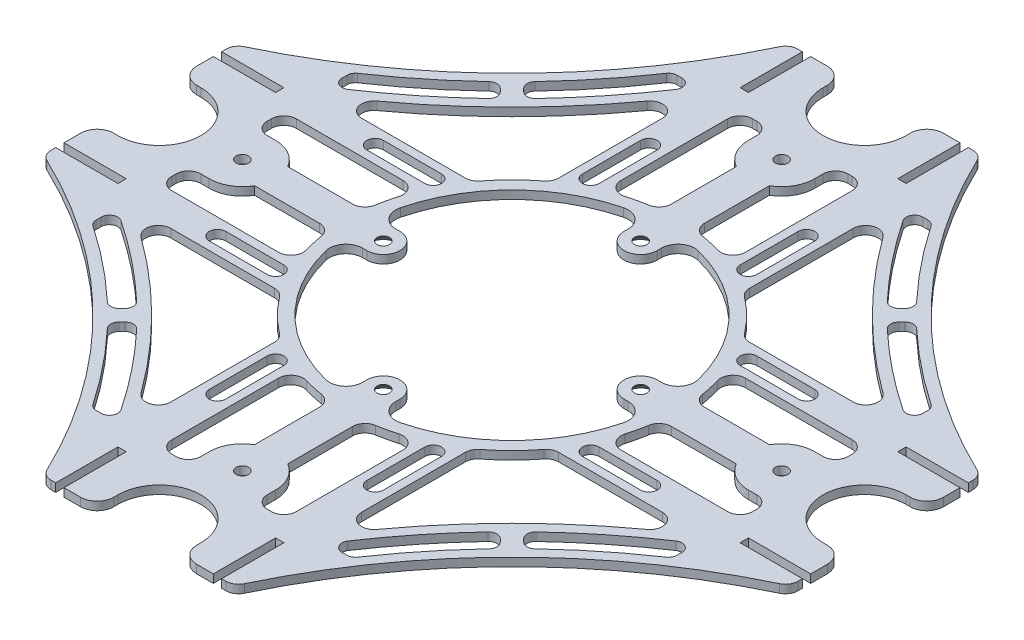
from build123d import *

# Parameters (mm, degrees)
SKETCH1_R           = 1.5
BOSS_EXTRUDE1_DEPTH = 2
CHAMFER1_SIZE       = 1.75


with BuildPart() as part:
    # Sketch1 → Boss-Extrude1 (new body)
    with BuildSketch(Plane(origin=(0, 0, 0), x_dir=(1, 0, 0), z_dir=(0, 1, 0))):
        with BuildLine():
            Line((-21.092083514, 90), (-20, 90))
            Line((-20, 90), (-20, 75))
            Line((-20, 75), (-18, 75))
            Line((-18, 75), (-18, 90))
            Line((-18, 90), (-14, 90))
            ThreePointArc((-14, 90), (-11.171572875, 88.828427125), (-10, 86))
            Line((-10, 86), (-10, 85))
            ThreePointArc((-10, 85), (0, 75), (10, 85))
            Line((10, 85), (10, 86))
            ThreePointArc((10, 86), (11.171572875, 88.828427125), (14, 90))
            Line((14, 90), (18, 90))
            Line((18, 90), (18, 75))
            Line((18, 75), (20, 75))
            Line((20, 75), (20, 90))
            Line((20, 90), (21.092083514, 90))
            ThreePointArc((21.092083514, 90), (22.693292478, 89.536952867), (23.800211296, 88.290753235))
            ThreePointArc((23.800211296, 88.290753235), (50.499949777, 50.499949777), (88.290753235, 23.800211296))
            ThreePointArc((88.290753235, 23.800211296), (89.536952867, 22.693292478), (90, 21.092083514))
            Line((90, 21.092083514), (90, 20))
            Line((90, 20), (75, 20))
            Line((75, 20), (75, 18))
            Line((75, 18), (90, 18))
            Line((90, 18), (90, 14))
            ThreePointArc((90, 14), (88.828427125, 11.171572875), (86, 10))
            Line((86, 10), (85, 10))
            ThreePointArc((85, 10), (75, 0), (85, -10))
            Line((85, -10), (86, -10))
            ThreePointArc((86, -10), (88.828427125, -11.171572875), (90, -14))
            Line((90, -14), (90, -18))
            Line((90, -18), (75, -18))
            Line((75, -18), (75, -20))
            Line((75, -20), (90, -20))
            Line((90, -20), (90, -21.092083514))
            ThreePointArc((90, -21.092083514), (89.536952867, -22.693292478), (88.290753235, -23.800211296))
            ThreePointArc((88.290753235, -23.800211296), (50.499949777, -50.499949777), (23.800211296, -88.290753235))
            ThreePointArc((23.800211296, -88.290753235), (22.693292478, -89.536952867), (21.092083514, -90))
            Line((21.092083514, -90), (20, -90))
            Line((20, -90), (20, -75))
            Line((20, -75), (18, -75))
            Line((18, -75), (18, -90))
            Line((18, -90), (14, -90))
            ThreePointArc((14, -90), (11.171572875, -88.828427125), (10, -86))
            Line((10, -86), (10, -85))
            ThreePointArc((10, -85), (0, -75), (-10, -85))
            Line((-10, -85), (-10, -86))
            ThreePointArc((-10, -86), (-11.171572875, -88.828427125), (-14, -90))
            Line((-14, -90), (-18, -90))
            Line((-18, -90), (-18, -75))
            Line((-18, -75), (-20, -75))
            Line((-20, -75), (-20, -90))
            Line((-20, -90), (-21.092083514, -90))
            ThreePointArc((-21.092083514, -90), (-22.693292478, -89.536952867), (-23.800211296, -88.290753235))
            ThreePointArc((-23.800211296, -88.290753235), (-50.499949777, -50.499949777), (-88.290753235, -23.800211296))
            ThreePointArc((-88.290753235, -23.800211296), (-89.536952867, -22.693292478), (-90, -21.092083514))
            Line((-90, -21.092083514), (-90, -20))
            Line((-90, -20), (-75, -20))
            Line((-75, -20), (-75, -18))
            Line((-75, -18), (-90, -18))
            Line((-90, -18), (-90, -14))
            ThreePointArc((-90, -14), (-88.828427125, -11.171572875), (-86, -10))
            Line((-86, -10), (-85, -10))
            ThreePointArc((-85, -10), (-75, 0), (-85, 10))
            Line((-85, 10), (-86, 10))
            ThreePointArc((-86, 10), (-88.828427125, 11.171572875), (-90, 14))
            Line((-90, 14), (-90, 18))
            Line((-90, 18), (-75, 18))
            Line((-75, 18), (-75, 20))
            Line((-75, 20), (-90, 20))
            Line((-90, 20), (-90, 21.092083514))
            ThreePointArc((-90, 21.092083514), (-89.536952867, 22.693292478), (-88.290753235, 23.800211296))
            ThreePointArc((-88.290753235, 23.800211296), (-50.499949777, 50.499949777), (-23.800211296, 88.290753235))
            ThreePointArc((-23.800211296, 88.290753235), (-22.693292478, 89.536952867), (-21.092083514, 90))
        make_face()
        with Locations(Location((0, 31, 0), (0, 0, 270))):
            Circle(SKETCH1_R, mode=Mode.SUBTRACT)
        with Locations(Location((0, 65, 0), (0, 0, 270))):
            Circle(SKETCH1_R, mode=Mode.SUBTRACT)
        with Locations(Location((65, 0, 0), (0, 0, 270))):
            Circle(SKETCH1_R, mode=Mode.SUBTRACT)
        with Locations(Location((31, 0, 0), (0, 0, 270))):
            Circle(SKETCH1_R, mode=Mode.SUBTRACT)
        with Locations(Location((0, -65, 0), (0, 0, 270))):
            Circle(SKETCH1_R, mode=Mode.SUBTRACT)
        with Locations(Location((0, -31, 0), (0, 0, 270))):
            Circle(SKETCH1_R, mode=Mode.SUBTRACT)
        with Locations(Location((-65, 0, 0), (0, 0, 270))):
            Circle(SKETCH1_R, mode=Mode.SUBTRACT)
        with Locations(Location((-31, 0, 0), (0, 0, 270))):
            Circle(SKETCH1_R, mode=Mode.SUBTRACT)
        with BuildLine():
            Line((4, 31), (4, 32.015621187))
            ThreePointArc((4, 32.015621187), (5.53817018, 35.168301624), (8.96969697, 35.896302543))
            ThreePointArc((8.96969697, 35.896302543), (26.162950904, 26.162950904), (35.896302543, 8.96969697))
            ThreePointArc((35.896302543, 8.96969697), (35.168301624, 5.53817018), (32.015621187, 4))
            Line((32.015621187, 4), (31, 4))
            ThreePointArc((31, 4), (27, 0), (31, -4))
            Line((31, -4), (32.015621187, -4))
            ThreePointArc((32.015621187, -4), (35.168301624, -5.53817018), (35.896302543, -8.96969697))
            ThreePointArc((35.896302543, -8.96969697), (26.162950904, -26.162950904), (8.96969697, -35.896302543))
            ThreePointArc((8.96969697, -35.896302543), (5.53817018, -35.168301624), (4, -32.015621187))
            Line((4, -32.015621187), (4, -31))
            ThreePointArc((4, -31), (0, -27), (-4, -31))
            Line((-4, -31), (-4, -32.015621187))
            ThreePointArc((-4, -32.015621187), (-5.53817018, -35.168301624), (-8.96969697, -35.896302543))
            ThreePointArc((-8.96969697, -35.896302543), (-26.162950904, -26.162950904), (-35.896302543, -8.96969697))
            ThreePointArc((-35.896302543, -8.96969697), (-35.168301624, -5.53817018), (-32.015621187, -4))
            Line((-32.015621187, -4), (-31, -4))
            ThreePointArc((-31, -4), (-27, 0), (-31, 4))
            Line((-31, 4), (-32.015621187, 4))
            ThreePointArc((-32.015621187, 4), (-35.168301624, 5.53817018), (-35.896302543, 8.96969697))
            ThreePointArc((-35.896302543, 8.96969697), (-26.162950904, 26.162950904), (-8.96969697, 35.896302543))
            ThreePointArc((-8.96969697, 35.896302543), (-5.53817018, 35.168301624), (-4, 32.015621187))
            Line((-4, 32.015621187), (-4, 31))
            ThreePointArc((-4, 31), (0, 27), (4, 31))
        make_face(mode=Mode.SUBTRACT)
        with BuildLine():
            Line((-4, 58.07179677), (-4, 42.426406871))
            ThreePointArc((-4, 42.426406871), (-4.712521445, 40.485416954), (-6.511627907, 39.466424996))
            ThreePointArc((-6.511627907, 39.466424996), (-8.852956387, 39.00801409), (-11.162790698, 38.410833157))
            ThreePointArc((-11.162790698, 38.410833157), (-13.801162415, 38.892517896), (-15, 41.291645644))
            Line((-15, 41.291645644), (-15, 67))
            ThreePointArc((-15, 67), (-14.121320344, 69.121320344), (-12, 70))
            Line((-12, 70), (-11, 70))
            ThreePointArc((-11, 70), (-8.878679656, 69.121320344), (-8, 67))
            Line((-8, 67), (-8, 65))
            ThreePointArc((-8, 65), (-6.92820323, 61), (-4, 58.07179677))
        make_face(mode=Mode.SUBTRACT)
        with BuildLine():
            Line((4, 58.07179677), (4, 42.426406871))
            ThreePointArc((4, 42.426406871), (4.712521445, 40.485416954), (6.511627907, 39.466424996))
            ThreePointArc((6.511627907, 39.466424996), (8.852956387, 39.00801409), (11.162790698, 38.410833157))
            ThreePointArc((11.162790698, 38.410833157), (13.801162415, 38.892517896), (15, 41.291645644))
            Line((15, 41.291645644), (15, 67))
            ThreePointArc((15, 67), (14.121320343, 69.121320344), (12, 70))
            Line((12, 70), (11, 70))
            ThreePointArc((11, 70), (8.878679656, 69.121320344), (8, 67))
            Line((8, 67), (8, 65))
            ThreePointArc((8, 65), (6.92820323, 61), (4, 58.07179677))
        make_face(mode=Mode.SUBTRACT)
        with BuildLine():
            Line((41.291645644, 15), (67, 15))
            ThreePointArc((67, 15), (69.121320344, 14.121320344), (70, 12))
            Line((70, 12), (70, 11))
            ThreePointArc((70, 11), (69.121320344, 8.878679656), (67, 8))
            Line((67, 8), (65, 8))
            ThreePointArc((65, 8), (61, 6.92820323), (58.07179677, 4))
            Line((58.07179677, 4), (42.426406871, 4))
            ThreePointArc((42.426406871, 4), (40.485416954, 4.712521445), (39.466424996, 6.511627907))
            ThreePointArc((39.466424996, 6.511627907), (39.00801409, 8.852956387), (38.410833157, 11.162790698))
            ThreePointArc((38.410833157, 11.162790698), (38.892517896, 13.801162415), (41.291645644, 15))
        make_face(mode=Mode.SUBTRACT)
        with BuildLine():
            Line((58.07179677, -4), (42.426406871, -4))
            ThreePointArc((42.426406871, -4), (40.485416954, -4.712521445), (39.466424996, -6.511627907))
            ThreePointArc((39.466424996, -6.511627907), (39.00801409, -8.852956387), (38.410833157, -11.162790698))
            ThreePointArc((38.410833157, -11.162790698), (38.892517896, -13.801162415), (41.291645644, -15))
            Line((41.291645644, -15), (67, -15))
            ThreePointArc((67, -15), (69.121320344, -14.121320343), (70, -12))
            Line((70, -12), (70, -11))
            ThreePointArc((70, -11), (69.121320344, -8.878679656), (67, -8))
            Line((67, -8), (65, -8))
            ThreePointArc((65, -8), (61, -6.92820323), (58.07179677, -4))
        make_face(mode=Mode.SUBTRACT)
        with BuildLine():
            Line((15, -41.291645644), (15, -67))
            ThreePointArc((15, -67), (14.121320344, -69.121320344), (12, -70))
            Line((12, -70), (11, -70))
            ThreePointArc((11, -70), (8.878679656, -69.121320344), (8, -67))
            Line((8, -67), (8, -65))
            ThreePointArc((8, -65), (6.92820323, -61), (4, -58.07179677))
            Line((4, -58.07179677), (4, -42.426406871))
            ThreePointArc((4, -42.426406871), (4.712521445, -40.485416954), (6.511627907, -39.466424996))
            ThreePointArc((6.511627907, -39.466424996), (8.852956387, -39.00801409), (11.162790698, -38.410833157))
            ThreePointArc((11.162790698, -38.410833157), (13.801162415, -38.892517896), (15, -41.291645644))
        make_face(mode=Mode.SUBTRACT)
        with BuildLine():
            Line((-4, -58.07179677), (-4, -42.426406871))
            ThreePointArc((-4, -42.426406871), (-4.712521445, -40.485416954), (-6.511627907, -39.466424996))
            ThreePointArc((-6.511627907, -39.466424996), (-8.852956387, -39.00801409), (-11.162790698, -38.410833157))
            ThreePointArc((-11.162790698, -38.410833157), (-13.801162415, -38.892517896), (-15, -41.291645644))
            Line((-15, -41.291645644), (-15, -67))
            ThreePointArc((-15, -67), (-14.121320343, -69.121320344), (-12, -70))
            Line((-12, -70), (-11, -70))
            ThreePointArc((-11, -70), (-8.878679656, -69.121320344), (-8, -67))
            Line((-8, -67), (-8, -65))
            ThreePointArc((-8, -65), (-6.92820323, -61), (-4, -58.07179677))
        make_face(mode=Mode.SUBTRACT)
        with BuildLine():
            Line((-41.291645644, -15), (-67, -15))
            ThreePointArc((-67, -15), (-69.121320344, -14.121320344), (-70, -12))
            Line((-70, -12), (-70, -11))
            ThreePointArc((-70, -11), (-69.121320344, -8.878679656), (-67, -8))
            Line((-67, -8), (-65, -8))
            ThreePointArc((-65, -8), (-61, -6.92820323), (-58.07179677, -4))
            Line((-58.07179677, -4), (-42.426406871, -4))
            ThreePointArc((-42.426406871, -4), (-40.485416954, -4.712521445), (-39.466424996, -6.511627907))
            ThreePointArc((-39.466424996, -6.511627907), (-39.00801409, -8.852956387), (-38.410833157, -11.162790698))
            ThreePointArc((-38.410833157, -11.162790698), (-38.892517896, -13.801162415), (-41.291645644, -15))
        make_face(mode=Mode.SUBTRACT)
        with BuildLine():
            Line((-58.07179677, 4), (-42.426406871, 4))
            ThreePointArc((-42.426406871, 4), (-40.485416954, 4.712521445), (-39.466424996, 6.511627907))
            ThreePointArc((-39.466424996, 6.511627907), (-39.00801409, 8.852956387), (-38.410833157, 11.162790698))
            ThreePointArc((-38.410833157, 11.162790698), (-38.892517896, 13.801162415), (-41.291645644, 15))
            Line((-41.291645644, 15), (-67, 15))
            ThreePointArc((-67, 15), (-69.121320344, 14.121320343), (-70, 12))
            Line((-70, 12), (-70, 11))
            ThreePointArc((-70, 11), (-69.121320344, 8.878679656), (-67, 8))
            Line((-67, 8), (-65, 8))
            ThreePointArc((-65, 8), (-61, 6.92820323), (-58.07179677, 4))
        make_face(mode=Mode.SUBTRACT)
        with BuildLine():
            Line((-23, 34.249087579), (-23, 59.245294136))
            ThreePointArc((-23, 59.245294136), (-25.074118387, 62.098843371), (-28.428495493, 61.006659981))
            ThreePointArc((-28.428495493, 61.006659981), (-43.428881965, 43.428881965), (-61.006659981, 28.428495493))
            ThreePointArc((-61.006659981, 28.428495493), (-62.098843371, 25.074118388), (-59.245294136, 23))
            Line((-59.245294136, 23), (-34.249087579, 23))
            ThreePointArc((-34.249087579, 23), (-32.915269838, 23.312821139), (-31.859616353, 24.186046512))
            ThreePointArc((-31.859616353, 24.186046512), (-28.284271247, 28.284271248), (-24.186046512, 31.859616353))
            ThreePointArc((-24.186046512, 31.859616353), (-23.312821139, 32.915269838), (-23, 34.249087579))
        make_face(mode=Mode.SUBTRACT)
        with BuildLine():
            Line((23, 34.249087579), (23, 59.245294136))
            ThreePointArc((23, 59.245294136), (25.074118388, 62.098843371), (28.428495493, 61.006659981))
            ThreePointArc((28.428495493, 61.006659981), (43.428881965, 43.428881965), (61.006659981, 28.428495493))
            ThreePointArc((61.006659981, 28.428495493), (62.098843371, 25.074118387), (59.245294136, 23))
            Line((59.245294136, 23), (34.249087579, 23))
            ThreePointArc((34.249087579, 23), (32.915269838, 23.312821139), (31.859616353, 24.186046512))
            ThreePointArc((31.859616353, 24.186046512), (28.284271248, 28.284271247), (24.186046512, 31.859616353))
            ThreePointArc((24.186046512, 31.859616353), (23.312821139, 32.915269838), (23, 34.249087579))
        make_face(mode=Mode.SUBTRACT)
        with BuildLine():
            Line((34.249087579, -23), (59.245294136, -23))
            ThreePointArc((59.245294136, -23), (62.098843371, -25.074118388), (61.006659981, -28.428495493))
            ThreePointArc((61.006659981, -28.428495493), (43.428881965, -43.428881965), (28.428495493, -61.006659981))
            ThreePointArc((28.428495493, -61.006659981), (25.074118387, -62.098843371), (23, -59.245294136))
            Line((23, -59.245294136), (23, -34.249087579))
            ThreePointArc((23, -34.249087579), (23.312821139, -32.915269838), (24.186046512, -31.859616353))
            ThreePointArc((24.186046512, -31.859616353), (28.284271247, -28.284271248), (31.859616353, -24.186046512))
            ThreePointArc((31.859616353, -24.186046512), (32.915269838, -23.312821139), (34.249087579, -23))
        make_face(mode=Mode.SUBTRACT)
        with BuildLine():
            Line((-23, -34.249087579), (-23, -59.245294136))
            ThreePointArc((-23, -59.245294136), (-25.074118388, -62.098843371), (-28.428495493, -61.006659981))
            ThreePointArc((-28.428495493, -61.006659981), (-43.428881965, -43.428881965), (-61.006659981, -28.428495493))
            ThreePointArc((-61.006659981, -28.428495493), (-62.098843371, -25.074118387), (-59.245294136, -23))
            Line((-59.245294136, -23), (-34.249087579, -23))
            ThreePointArc((-34.249087579, -23), (-32.915269838, -23.312821139), (-31.859616353, -24.186046512))
            ThreePointArc((-31.859616353, -24.186046512), (-28.284271248, -28.284271247), (-24.186046512, -31.859616353))
            ThreePointArc((-24.186046512, -31.859616353), (-23.312821139, -32.915269838), (-23, -34.249087579))
        make_face(mode=Mode.SUBTRACT)
        with BuildLine():
            Line((-17, 52), (-17, 38))
            ThreePointArc((-17, 38), (-19, 36), (-21, 38))
            Line((-21, 38), (-21, 52))
            ThreePointArc((-21, 52), (-19, 54), (-17, 52))
        make_face(mode=Mode.SUBTRACT)
        with BuildLine():
            Line((17, 52), (17, 38))
            ThreePointArc((17, 38), (19, 36), (21, 38))
            Line((21, 38), (21, 52))
            ThreePointArc((21, 52), (19, 54), (17, 52))
        make_face(mode=Mode.SUBTRACT)
        with BuildLine():
            Line((52, 17), (38, 17))
            ThreePointArc((38, 17), (36, 19), (38, 21))
            Line((38, 21), (52, 21))
            ThreePointArc((52, 21), (54, 19), (52, 17))
        make_face(mode=Mode.SUBTRACT)
        with BuildLine():
            Line((52, -17), (38, -17))
            ThreePointArc((38, -17), (36, -19), (38, -21))
            Line((38, -21), (52, -21))
            ThreePointArc((52, -21), (54, -19), (52, -17))
        make_face(mode=Mode.SUBTRACT)
        with BuildLine():
            Line((17, -52), (17, -38))
            ThreePointArc((17, -38), (19, -36), (21, -38))
            Line((21, -38), (21, -52))
            ThreePointArc((21, -52), (19, -54), (17, -52))
        make_face(mode=Mode.SUBTRACT)
        with BuildLine():
            Line((-17, -52), (-17, -38))
            ThreePointArc((-17, -38), (-19, -36), (-21, -38))
            Line((-21, -38), (-21, -52))
            ThreePointArc((-21, -52), (-19, -54), (-17, -52))
        make_face(mode=Mode.SUBTRACT)
        with BuildLine():
            Line((-52, -17), (-38, -17))
            ThreePointArc((-38, -17), (-36, -19), (-38, -21))
            Line((-38, -21), (-52, -21))
            ThreePointArc((-52, -21), (-54, -19), (-52, -17))
        make_face(mode=Mode.SUBTRACT)
        with BuildLine():
            Line((-52, 17), (-38, 17))
            ThreePointArc((-38, 17), (-36, 19), (-38, 21))
            Line((-38, 21), (-52, 21))
            ThreePointArc((-52, 21), (-54, 19), (-52, 17))
        make_face(mode=Mode.SUBTRACT)
        with BuildLine():
            Line((70, -29.037672557), (70, -30.243163041))
            ThreePointArc((70, -30.243163041), (69.766593169, -31.180792273), (69.120851424, -31.899572437))
            ThreePointArc((69.120851424, -31.899572437), (60.054874014, -38.585425566), (51.560048838, -45.983433656))
            ThreePointArc((51.560048838, -45.983433656), (50.158152346, -46.529468498), (48.772310433, -45.943883308))
            Line((48.772310433, -45.943883308), (48.06492095, -45.236493825))
            ThreePointArc((48.06492095, -45.236493825), (47.479332935, -43.794108454), (48.105319148, -42.368790895))
            ThreePointArc((48.105319148, -42.368790895), (57.182866458, -34.479877587), (66.887041896, -27.375949278))
            ThreePointArc((66.887041896, -27.375949278), (68.941829016, -27.273314854), (70, -29.037672557))
        make_face(mode=Mode.SUBTRACT)
        with BuildLine():
            Line((48.06492095, 45.236493825), (48.772310433, 45.943883308))
            ThreePointArc((48.772310433, 45.943883308), (50.158152346, 46.529468498), (51.560048838, 45.983433656))
            ThreePointArc((51.560048838, 45.983433656), (60.054874014, 38.585425566), (69.120851424, 31.899572437))
            ThreePointArc((69.120851424, 31.899572437), (69.766593169, 31.180792273), (70, 30.243163041))
            Line((70, 30.243163041), (70, 29.037672557))
            ThreePointArc((70, 29.037672557), (68.941829016, 27.273314854), (66.887041896, 27.375949278))
            ThreePointArc((66.887041896, 27.375949278), (57.182866458, 34.479877587), (48.105319148, 42.368790895))
            ThreePointArc((48.105319148, 42.368790895), (47.479332935, 43.794108454), (48.06492095, 45.236493825))
        make_face(mode=Mode.SUBTRACT)
        with BuildLine():
            Line((45.236493825, 48.06492095), (45.943883308, 48.772310433))
            ThreePointArc((45.943883308, 48.772310433), (46.529468498, 50.158152346), (45.983433656, 51.560048838))
            ThreePointArc((45.983433656, 51.560048838), (38.585425566, 60.054874014), (31.899572437, 69.120851424))
            ThreePointArc((31.899572437, 69.120851424), (31.180792273, 69.766593169), (30.243163041, 70))
            Line((30.243163041, 70), (29.037672557, 70))
            ThreePointArc((29.037672557, 70), (27.273314854, 68.941829016), (27.375949278, 66.887041896))
            ThreePointArc((27.375949278, 66.887041896), (34.479877587, 57.182866458), (42.368790895, 48.105319148))
            ThreePointArc((42.368790895, 48.105319148), (43.794108454, 47.479332935), (45.236493825, 48.06492095))
        make_face(mode=Mode.SUBTRACT)
        with BuildLine():
            Line((45.236493825, -48.06492095), (45.943883308, -48.772310433))
            ThreePointArc((45.943883308, -48.772310433), (46.529468498, -50.158152346), (45.983433656, -51.560048838))
            ThreePointArc((45.983433656, -51.560048838), (38.585425566, -60.054874014), (31.899572437, -69.120851424))
            ThreePointArc((31.899572437, -69.120851424), (31.180792273, -69.766593169), (30.243163041, -70))
            Line((30.243163041, -70), (29.037672557, -70))
            ThreePointArc((29.037672557, -70), (27.273314854, -68.941829016), (27.375949278, -66.887041896))
            ThreePointArc((27.375949278, -66.887041896), (34.479877587, -57.182866458), (42.368790895, -48.105319148))
            ThreePointArc((42.368790895, -48.105319148), (43.794108454, -47.479332935), (45.236493825, -48.06492095))
        make_face(mode=Mode.SUBTRACT)
        with BuildLine():
            Line((-29.037672557, -70), (-30.243163041, -70))
            ThreePointArc((-30.243163041, -70), (-31.180792273, -69.766593169), (-31.899572437, -69.120851424))
            ThreePointArc((-31.899572437, -69.120851424), (-38.585425566, -60.054874014), (-45.983433656, -51.560048838))
            ThreePointArc((-45.983433656, -51.560048838), (-46.529468498, -50.158152346), (-45.943883308, -48.772310433))
            Line((-45.943883308, -48.772310433), (-45.236493825, -48.06492095))
            ThreePointArc((-45.236493825, -48.06492095), (-43.794108454, -47.479332935), (-42.368790895, -48.105319148))
            ThreePointArc((-42.368790895, -48.105319148), (-34.479877587, -57.182866458), (-27.375949278, -66.887041896))
            ThreePointArc((-27.375949278, -66.887041896), (-27.273314854, -68.941829016), (-29.037672557, -70))
        make_face(mode=Mode.SUBTRACT)
        with BuildLine():
            Line((-48.06492095, -45.236493825), (-48.772310433, -45.943883308))
            ThreePointArc((-48.772310433, -45.943883308), (-50.158152346, -46.529468498), (-51.560048838, -45.983433656))
            ThreePointArc((-51.560048838, -45.983433656), (-60.054874014, -38.585425566), (-69.120851424, -31.899572437))
            ThreePointArc((-69.120851424, -31.899572437), (-69.766593169, -31.180792273), (-70, -30.243163041))
            Line((-70, -30.243163041), (-70, -29.037672557))
            ThreePointArc((-70, -29.037672557), (-68.941829016, -27.273314854), (-66.887041896, -27.375949278))
            ThreePointArc((-66.887041896, -27.375949278), (-57.182866458, -34.479877587), (-48.105319148, -42.368790895))
            ThreePointArc((-48.105319148, -42.368790895), (-47.479332935, -43.794108454), (-48.06492095, -45.236493825))
        make_face(mode=Mode.SUBTRACT)
        with BuildLine():
            Line((-70, 29.037672557), (-70, 30.243163041))
            ThreePointArc((-70, 30.243163041), (-69.766593169, 31.180792273), (-69.120851424, 31.899572437))
            ThreePointArc((-69.120851424, 31.899572437), (-60.054874014, 38.585425566), (-51.560048838, 45.983433656))
            ThreePointArc((-51.560048838, 45.983433656), (-50.158152346, 46.529468498), (-48.772310433, 45.943883308))
            Line((-48.772310433, 45.943883308), (-48.06492095, 45.236493825))
            ThreePointArc((-48.06492095, 45.236493825), (-47.479332935, 43.794108454), (-48.105319148, 42.368790895))
            ThreePointArc((-48.105319148, 42.368790895), (-57.182866458, 34.479877587), (-66.887041896, 27.375949278))
            ThreePointArc((-66.887041896, 27.375949278), (-68.941829016, 27.273314854), (-70, 29.037672557))
        make_face(mode=Mode.SUBTRACT)
        with BuildLine():
            Line((-45.236493825, 48.06492095), (-45.943883308, 48.772310433))
            ThreePointArc((-45.943883308, 48.772310433), (-46.529468498, 50.158152346), (-45.983433656, 51.560048838))
            ThreePointArc((-45.983433656, 51.560048838), (-38.585425566, 60.054874014), (-31.899572437, 69.120851424))
            ThreePointArc((-31.899572437, 69.120851424), (-31.180792273, 69.766593169), (-30.243163041, 70))
            Line((-30.243163041, 70), (-29.037672557, 70))
            ThreePointArc((-29.037672557, 70), (-27.273314854, 68.941829016), (-27.375949278, 66.887041896))
            ThreePointArc((-27.375949278, 66.887041896), (-34.479877587, 57.182866458), (-42.368790895, 48.105319148))
            ThreePointArc((-42.368790895, 48.105319148), (-43.794108454, 47.479332935), (-45.236493825, 48.06492095))
        make_face(mode=Mode.SUBTRACT)
    extrude(amount=BOSS_EXTRUDE1_DEPTH)

    # Chamfer1
    chamfer1_edges = [part.edges().sort_by_distance(p)[0] for p in [
        (0, 0, -32.5),
        (31, 0, -1.5),
        (0, 0, 29.5),
        (-31, 0, -1.5),
    ]]
    chamfer(chamfer1_edges, length=CHAMFER1_SIZE)


solid = part.part
